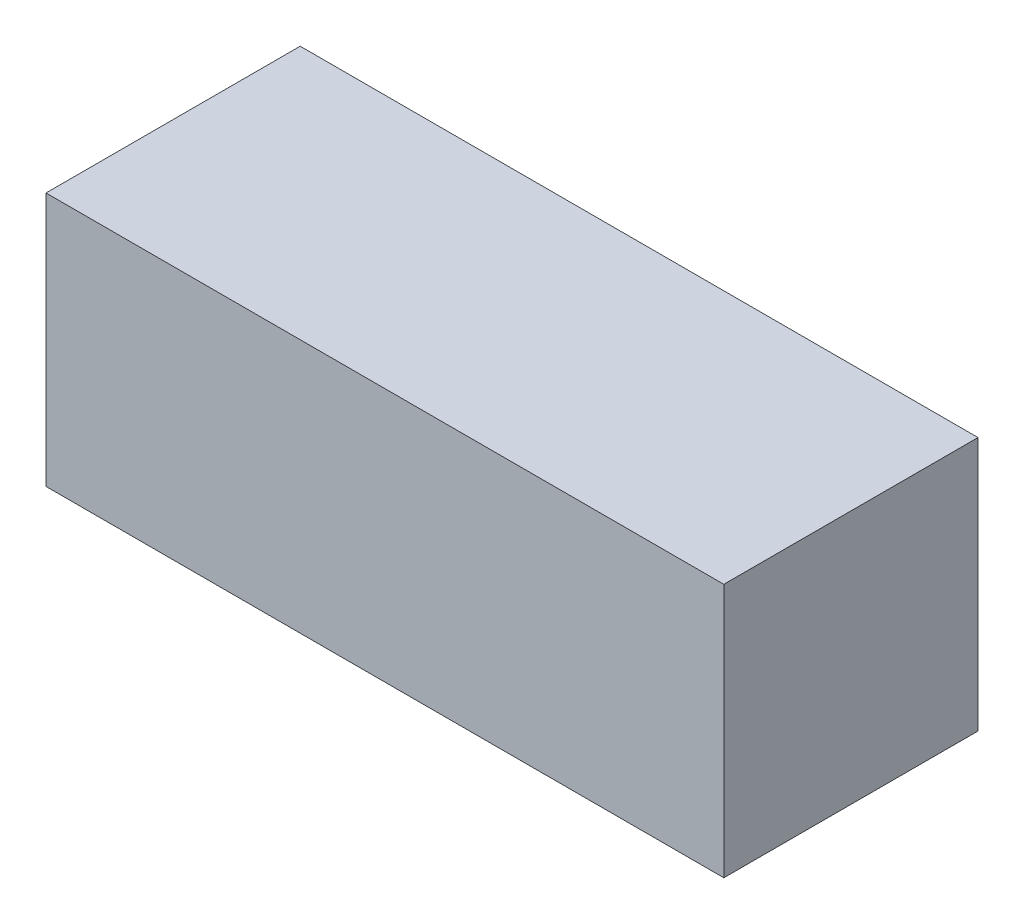
from build123d import *

# Parameters (mm, degrees)
ESQUISSE1_W      = 16
ESQUISSE1_H      = 6
EXTRUSION1_DEPTH = 6


with BuildPart() as part:
    # Esquisse1 → Extrusion1 (new body)
    with BuildSketch(Plane.XY):
        with Locations((8, 3)):
            Rectangle(ESQUISSE1_W, ESQUISSE1_H)
    extrude(amount=EXTRUSION1_DEPTH)


solid = part.part
